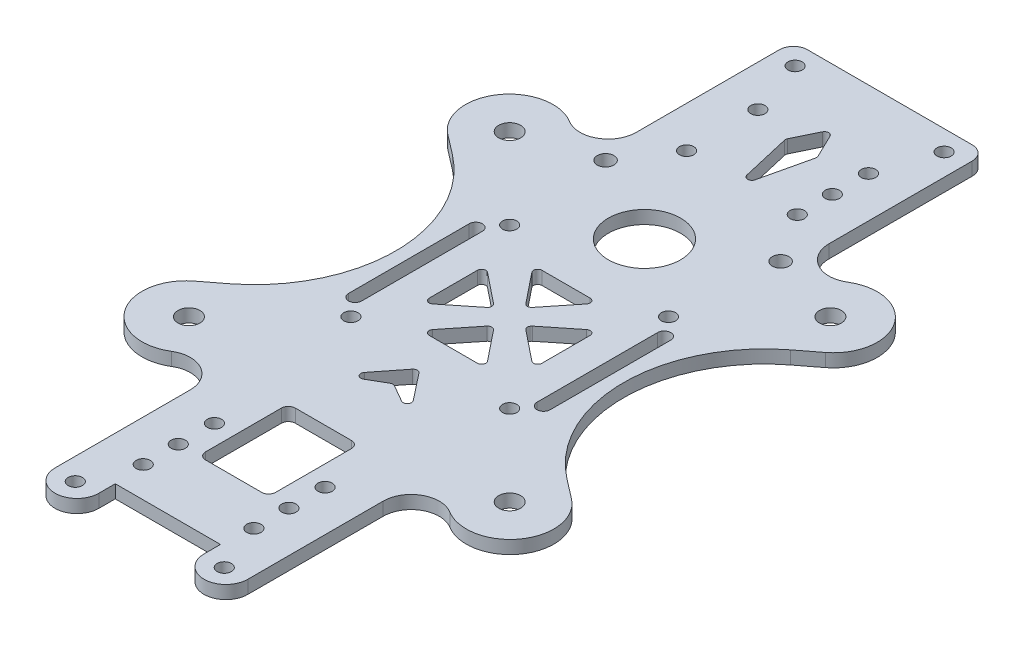
from build123d import *

# Parameters (mm, degrees)
SKETCH1_R           = 1.28984375
SKETCH1_R_2         = 6.5484375
SKETCH1_R_3         = 1.984375
SKETCH1_R_4         = 1.503965808
SKETCH1_W           = 12.7
SKETCH1_H           = 16.271875
BOSS_EXTRUDE1_DEPTH = 1.190625
FILLET1_RADIUS      = 3.96875
FILLET1_LENGTH      = 2.38125
FILLET2_RADIUS      = 3.96875
FILLET2_LENGTH      = 2.38125
FILLET3_RADIUS      = 7.9375
FILLET3_LENGTH      = 2.38125
FILLET4_RADIUS      = 7.9375
FILLET4_LENGTH      = 2.38125
FILLET5_RADIUS      = 7.9375
FILLET5_LENGTH      = 2.38125
FILLET6_RADIUS      = 7.9375
FILLET6_LENGTH      = 2.38125
FILLET9_R           = 5.08
FILLET10_R          = 2.54
FILLET11_R          = 0.762
FILLET14_R          = 1.27
FILLET16_R          = 25.521877
FILLET17_R          = 25.521877


with BuildPart() as part:
    # Sketch1 → Boss-Extrude1 (new, symmetric)
    with BuildSketch(Plane(origin=(0, 0, 0), x_dir=(1, 0, 0), z_dir=(0, 1, 0))):
        Polygon((17.4625, -68.8578125), (9.525, -68.8578125), (9.525, -61.9125), (-9.525, -61.9125), (-9.525, -68.8578125), (-17.4625, -68.8578125), (-17.4625, -30.156717438), (-30.819388458, -40.417371018), (-40.490328116, -27.828147407), (-20.6375, -12.577365571), (-20.6375, 12.577365571), (-40.490328116, 27.828147407), (-30.819388458, 40.417371018), (-17.4625, 30.156717438), (-17.4625, 68.8578125), (17.4625, 68.8578125), (17.4625, 30.156717438), (30.819388458, 40.417371018), (40.490328116, 27.828147407), (20.6375, 12.577365571), (20.6375, -12.577365571), (40.490328116, -27.828147407), (30.819388458, -40.417371018), (17.4625, -30.156717438), align=None)
        with Locations(Location((13.49375, -65.18671875, 0), (0, 0, 90))):
            Circle(SKETCH1_R, mode=Mode.SUBTRACT)
        with Locations(Location((10.02109375, -50.00625, 0), (0, 0, 90))):
            Circle(SKETCH1_R, mode=Mode.SUBTRACT)
        with Locations(Location((10.02109375, -43.4578125, 0), (0, 0, 90))):
            Circle(SKETCH1_R, mode=Mode.SUBTRACT)
        with Locations(Location((10.02109375, -56.35625, 0), (0, 0, 90))):
            Circle(SKETCH1_R, mode=Mode.SUBTRACT)
        with Locations(Location((0, 24.413359154, 0), (0, 0, 90))):
            Circle(SKETCH1_R_2, mode=Mode.SUBTRACT)
        with Locations(Location((10.02109375, 54.9671875, 0), (0, 0, 90))):
            Circle(SKETCH1_R, mode=Mode.SUBTRACT)
        with Locations(Location((10.02109375, 48.41875, 0), (0, 0, 90))):
            Circle(SKETCH1_R, mode=Mode.SUBTRACT)
        with Locations(Location((10.02109375, 42.06875, 0), (0, 0, 90))):
            Circle(SKETCH1_R, mode=Mode.SUBTRACT)
        with Locations(Location((14.382441444, -14.382441444, 0), (0, 0, 90))):
            Circle(SKETCH1_R, mode=Mode.SUBTRACT)
        with Locations(Location((14.382441444, 14.382441444, 0), (0, 0, 90))):
            Circle(SKETCH1_R, mode=Mode.SUBTRACT)
        with Locations(Location((13.49375, 65.18671875, 0), (0, 0, 90))):
            Circle(SKETCH1_R, mode=Mode.SUBTRACT)
        with Locations(Location((-13.49375, -65.18671875, 0), (0, 0, 90))):
            Circle(SKETCH1_R, mode=Mode.SUBTRACT)
        with Locations(Location((-10.02109375, -56.35625, 0), (0, 0, 90))):
            Circle(SKETCH1_R, mode=Mode.SUBTRACT)
        with Locations(Location((-10.02109375, -50.00625, 0), (0, 0, 90))):
            Circle(SKETCH1_R, mode=Mode.SUBTRACT)
        with Locations(Location((-10.02109375, -43.4578125, 0), (0, 0, 90))):
            Circle(SKETCH1_R, mode=Mode.SUBTRACT)
        with Locations(Location((-14.382441444, -14.382441444, 0), (0, 0, 90))):
            Circle(SKETCH1_R, mode=Mode.SUBTRACT)
        with Locations(Location((-14.382441444, 14.382441444, 0), (0, 0, 90))):
            Circle(SKETCH1_R, mode=Mode.SUBTRACT)
        with Locations(Location((-10.02109375, 42.06875, 0), (0, 0, 90))):
            Circle(SKETCH1_R, mode=Mode.SUBTRACT)
        with Locations(Location((-10.02109375, 54.9671875, 0), (0, 0, 90))):
            Circle(SKETCH1_R, mode=Mode.SUBTRACT)
        with Locations(Location((-13.49375, 65.18671875, 0), (0, 0, 90))):
            Circle(SKETCH1_R, mode=Mode.SUBTRACT)
        with Locations(Location((29.045515892, -29.045515892, 0), (0, 0, 90))):
            Circle(SKETCH1_R_3, mode=Mode.SUBTRACT)
        with Locations(Location((-29.045515892, -29.045515892, 0), (0, 0, 90))):
            Circle(SKETCH1_R_3, mode=Mode.SUBTRACT)
        with Locations(Location((-29.045515892, 29.045515892, 0), (0, 0, 90))):
            Circle(SKETCH1_R_3, mode=Mode.SUBTRACT)
        with Locations(Location((29.045515892, 29.045515892, 0), (0, 0, 90))):
            Circle(SKETCH1_R_3, mode=Mode.SUBTRACT)
        with Locations(Location((15.853314823, 33.223947459, 0), (0, 0, 90))):
            Circle(SKETCH1_R_4, mode=Mode.SUBTRACT)
        with Locations(Location((-15.853314823, 33.223947459, 0), (0, 0, 90))):
            Circle(SKETCH1_R_4, mode=Mode.SUBTRACT)
        Polygon((0, -16.271875), (6.874076643, -25.003125), (0, -21.034375), (-6.874076643, -25.003125), align=None, mode=Mode.SUBTRACT)
        with Locations((0, -41.8703125)):
            Rectangle(SKETCH1_W, SKETCH1_H, mode=Mode.SUBTRACT)
        Polygon((0, -2.778125), (5.953125, -10.213575742), (-5.953125, -10.213575742), align=None, mode=Mode.SUBTRACT)
        with BuildLine():
            Line((18.25625, 10.923362578), (18.25625, -10.923362578))
            ThreePointArc((18.25625, -10.923362578), (17.065625, -12.113987578), (15.875, -10.923362578))
            Line((15.875, -10.923362578), (15.875, 10.923362578))
            ThreePointArc((15.875, 10.923362578), (17.065625, 12.113987578), (18.25625, 10.923362578))
        make_face(mode=Mode.SUBTRACT)
        Polygon((0, 58.743046654), (2.86609794, 52.859164358), (0, 40.486796654), (-2.86609794, 52.859164358), align=None, mode=Mode.SUBTRACT)
        with BuildLine():
            Line((-18.25625, 10.923362578), (-18.25625, -10.923362578))
            ThreePointArc((-18.25625, -10.923362578), (-17.065625, -12.113987578), (-15.875, -10.923362578))
            Line((-15.875, -10.923362578), (-15.875, 10.923362578))
            ThreePointArc((-15.875, 10.923362578), (-17.065625, 12.113987578), (-18.25625, 10.923362578))
        make_face(mode=Mode.SUBTRACT)
        Polygon((-10.213575742, 5.953125), (-2.778125, 0), (-10.213575742, -5.953125), align=None, mode=Mode.SUBTRACT)
        Polygon((5.953125, 10.213575742), (0, 2.778125), (-5.953125, 10.213575742), align=None, mode=Mode.SUBTRACT)
        Polygon((10.213575742, -5.953125), (2.778125, 0), (10.213575742, 5.953125), align=None, mode=Mode.SUBTRACT)
    extrude(amount=BOSS_EXTRUDE1_DEPTH, both=True)

    # Fillet1: full round fillet: the end face becomes a half cylinder, R = half its width
    fillet1_face = Plane((-13.49375, 0, 68.8578125), x_dir=(0, 1, 0), z_dir=(0, 0, 1))  # on the end face: x along it, z out of the body
    fillet1_slab = fillet1_face.offset(-FILLET1_RADIUS / 2) * Box(FILLET1_LENGTH, 2 * FILLET1_RADIUS, FILLET1_RADIUS, mode=Mode.PRIVATE)  # the body's end, R deep
    fillet1_round = Plane((-13.49375, 0, 64.8890625), x_dir=(0, 0, 1), z_dir=(0, 1, 0)) * Cylinder(FILLET1_RADIUS, FILLET1_LENGTH, mode=Mode.PRIVATE)  # its axis R under the face
    add(fillet1_slab - fillet1_round, mode=Mode.SUBTRACT)

    # Fillet2: full round fillet: the end face becomes a half cylinder, R = half its width
    fillet2_face = Plane((13.49375, 0, 68.8578125), x_dir=(0, 1, 0), z_dir=(0, 0, 1))  # on the end face: x along it, z out of the body
    fillet2_slab = fillet2_face.offset(-FILLET2_RADIUS / 2) * Box(FILLET2_LENGTH, 2 * FILLET2_RADIUS, FILLET2_RADIUS, mode=Mode.PRIVATE)  # the body's end, R deep
    fillet2_round = Plane((13.49375, 0, 64.8890625), x_dir=(0, 0, 1), z_dir=(0, 1, 0)) * Cylinder(FILLET2_RADIUS, FILLET2_LENGTH, mode=Mode.PRIVATE)  # its axis R under the face
    add(fillet2_slab - fillet2_round, mode=Mode.SUBTRACT)

    # Fillet3: full round fillet: the end face becomes a half cylinder, R = half its width
    fillet3_face = Plane((35.654858287, 0, -34.122759212), x_dir=(0, 1, 0), z_dir=(0.793021959733, 0, -0.609193049355))  # on the end face: x along it, z out of the body
    fillet3_slab = fillet3_face.offset(-FILLET3_RADIUS / 2) * Box(FILLET3_LENGTH, 2 * FILLET3_RADIUS, FILLET3_RADIUS, mode=Mode.PRIVATE)  # the body's end, R deep
    fillet3_round = Plane((29.360246482, 0, -29.287289383), x_dir=(0.793021959733, 0, -0.609193049355), z_dir=(0, 1, 0)) * Cylinder(FILLET3_RADIUS, FILLET3_LENGTH, mode=Mode.PRIVATE)  # its axis R under the face
    add(fillet3_slab - fillet3_round, mode=Mode.SUBTRACT)

    # Fillet4: full round fillet: the end face becomes a half cylinder, R = half its width
    fillet4_face = Plane((35.654858287, 0, 34.122759212), x_dir=(0, 1, 0), z_dir=(0.793021959733, 0, 0.609193049355))  # on the end face: x along it, z out of the body
    fillet4_slab = fillet4_face.offset(-FILLET4_RADIUS / 2) * Box(FILLET4_LENGTH, 2 * FILLET4_RADIUS, FILLET4_RADIUS, mode=Mode.PRIVATE)  # the body's end, R deep
    fillet4_round = Plane((29.360246482, 0, 29.287289383), x_dir=(0.793021959733, 0, 0.609193049355), z_dir=(0, 1, 0)) * Cylinder(FILLET4_RADIUS, FILLET4_LENGTH, mode=Mode.PRIVATE)  # its axis R under the face
    add(fillet4_slab - fillet4_round, mode=Mode.SUBTRACT)

    # Fillet5: full round fillet: the end face becomes a half cylinder, R = half its width
    fillet5_face = Plane((-35.654858287, 0, 34.122759212), x_dir=(0, 1, 0), z_dir=(-0.793021959733, 0, 0.609193049355))  # on the end face: x along it, z out of the body
    fillet5_slab = fillet5_face.offset(-FILLET5_RADIUS / 2) * Box(FILLET5_LENGTH, 2 * FILLET5_RADIUS, FILLET5_RADIUS, mode=Mode.PRIVATE)  # the body's end, R deep
    fillet5_round = Plane((-29.360246482, 0, 29.287289383), x_dir=(-0.793021959733, 0, 0.609193049355), z_dir=(0, 1, 0)) * Cylinder(FILLET5_RADIUS, FILLET5_LENGTH, mode=Mode.PRIVATE)  # its axis R under the face
    add(fillet5_slab - fillet5_round, mode=Mode.SUBTRACT)

    # Fillet6: full round fillet: the end face becomes a half cylinder, R = half its width
    fillet6_face = Plane((-35.654858287, 0, -34.122759212), x_dir=(0, 1, 0), z_dir=(-0.793021959733, 0, -0.609193049355))  # on the end face: x along it, z out of the body
    fillet6_slab = fillet6_face.offset(-FILLET6_RADIUS / 2) * Box(FILLET6_LENGTH, 2 * FILLET6_RADIUS, FILLET6_RADIUS, mode=Mode.PRIVATE)  # the body's end, R deep
    fillet6_round = Plane((-29.360246482, 0, -29.287289383), x_dir=(-0.793021959733, 0, -0.609193049355), z_dir=(0, 1, 0)) * Cylinder(FILLET6_RADIUS, FILLET6_LENGTH, mode=Mode.PRIVATE)  # its axis R under the face
    add(fillet6_slab - fillet6_round, mode=Mode.SUBTRACT)

    # Fillet9
    fillet9_edges = [part.edges().sort_by_distance(p)[0] for p in [
        (-17.4625, 0, -30.156717438),
        (17.4625, 0, 30.156717438),
        (-17.4625, 0, 30.156717438),
        (17.4625, 0, -30.156717438),
    ]]
    fillet(fillet9_edges, radius=FILLET9_R)

    # Fillet10
    fillet10_edges = [part.edges().sort_by_distance(p)[0] for p in [
        (-17.4625, 0, -68.8578125),
        (17.4625, 0, -68.8578125),
    ]]
    fillet(fillet10_edges, radius=FILLET10_R)

    # Fillet11
    fillet11_edges = [part.edges().sort_by_distance(p)[0] for p in [
        (2.778125, 0, 0),
        (10.213575742, 0, 5.953125),
        (10.213575742, 0, -5.953125),
        (5.953125, 0, -10.213575742),
        (-5.953125, 0, -10.213575742),
        (0, 0, -2.778125),
        (-2.778125, 0, 0),
        (-10.213575742, 0, -5.953125),
        (-10.213575742, 0, 5.953125),
        (-5.953125, 0, 10.213575742),
        (5.953125, 0, 10.213575742),
        (0, 0, 2.778125),
        (-6.874076643, 0, 25.003125),
        (0, 0, 21.034375),
        (6.874076643, 0, 25.003125),
        (0, 0, 16.271875),
        (-2.86609794, 0, -52.859164358),
        (0, 0, -40.486796654),
        (2.86609794, 0, -52.859164358),
        (0, 0, -58.743046654),
    ]]
    fillet(fillet11_edges, radius=FILLET11_R)

    # Fillet14
    fillet14_edges = [part.edges().sort_by_distance(p)[0] for p in [
        (-6.35, 0, 33.734375),
        (-6.35, 0, 50.00625),
        (6.35, 0, 50.00625),
        (6.35, 0, 33.734375),
    ]]
    fillet(fillet14_edges, radius=FILLET14_R)

    # Fillet16
    fillet16_edges = [part.edges().sort_by_distance(p)[0] for p in [
        (20.6375, 0, -12.577365571),
        (20.6375, 0, 12.577365571),
    ]]
    fillet(fillet16_edges, radius=FILLET16_R)

    # Fillet17
    fillet17_edges = [part.edges().sort_by_distance(p)[0] for p in [
        (-20.6375, 0, 12.577365571),
        (-20.6375, 0, -12.577365571),
    ]]
    fillet(fillet17_edges, radius=FILLET17_R)


solid = part.part
